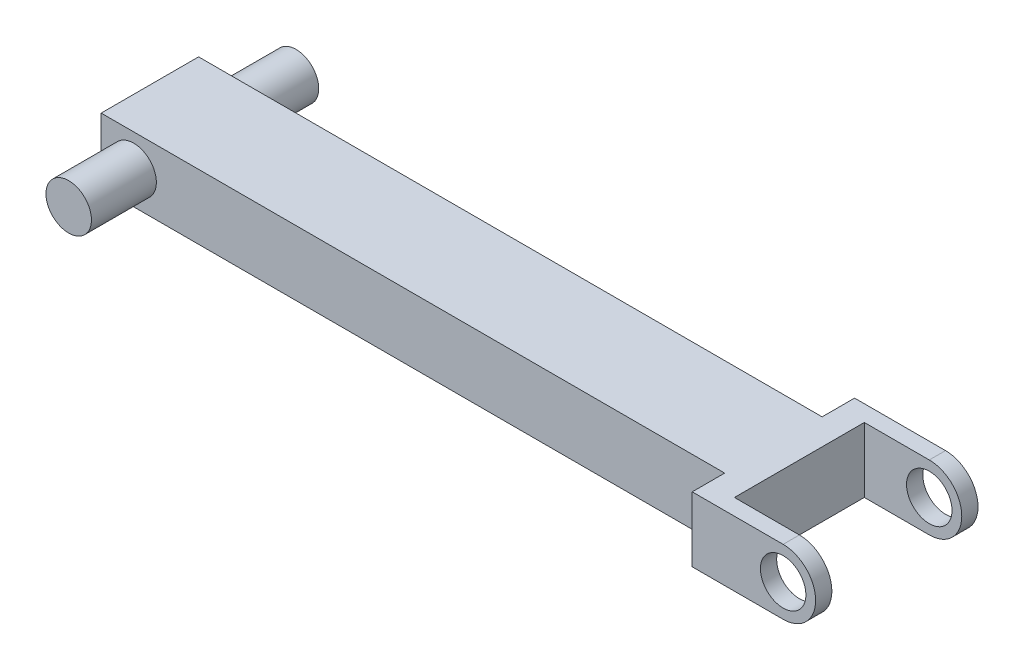
from build123d import *

# Parameters (mm, degrees)
SKETCH1_W           = 50.8
SKETCH1_H           = 5.08
BOSS_EXTRUDE1_DEPTH = 7.62
SKETCH2_R           = 1.778
BOSS_EXTRUDE2_DEPTH = 5.08
BOSS_EXTRUDE3_START = 5.08
SKETCH3_R           = 1.778
BOSS_EXTRUDE3_DEPTH = 5.08
SKETCH4_W           = 2.032
SKETCH4_H           = 5.08
BOSS_EXTRUDE4_DEPTH = 2.54
BOSS_EXTRUDE5_DEPTH = 1.27
SKETCH6_W           = 2.032
SKETCH6_H           = 5.08
BOSS_EXTRUDE6_DEPTH = 2.54
BOSS_EXTRUDE7_START = -1.27
BOSS_EXTRUDE7_DEPTH = 1.27
SKETCH8_R           = 1.778
CUT_EXTRUDE1_DEPTH  = 61.588451045


with BuildPart() as part:
    # Sketch1 → Boss-Extrude1 (new body)
    with BuildSketch(Plane.XY):
        with Locations((25.4, -2.54)):
            Rectangle(SKETCH1_W, SKETCH1_H)
    extrude(amount=BOSS_EXTRUDE1_DEPTH)

    # Sketch2 → Boss-Extrude2 (add)
    with BuildSketch(Plane.XY.offset(7.62)):
        with Locations((2.54, -2.54)):
            Circle(SKETCH2_R)
    extrude(amount=BOSS_EXTRUDE2_DEPTH)

    # Sketch3 → Boss-Extrude3 (add)
    with BuildSketch(Plane(origin=(0, 0, 0), x_dir=(-1, 0, 0), z_dir=(0, 0, -1)).offset(BOSS_EXTRUDE3_START)):
        with Locations(Location((-2.54, -2.54, 0), (0, 0, 180))):
            Circle(SKETCH3_R)
    extrude(amount=-BOSS_EXTRUDE3_DEPTH)

    # Sketch4 → Boss-Extrude4 (add)
    with BuildSketch(Plane.XY.offset(7.62)):
        with Locations((49.784, -2.54)):
            Rectangle(SKETCH4_W, SKETCH4_H)
    extrude(amount=BOSS_EXTRUDE4_DEPTH)

    # Sketch5 → Boss-Extrude5 (add)
    with BuildSketch(Plane.XY.offset(10.16)):
        with BuildLine():
            Line((50.8, 0), (55.88, 0))
            ThreePointArc((55.88, 0), (58.42, -2.54), (55.88, -5.08))
            Line((55.88, -5.08), (50.8, -5.08))
            Line((50.8, -5.08), (50.8, 0))
        make_face()
    extrude(amount=-BOSS_EXTRUDE5_DEPTH)

    # Sketch6 → Boss-Extrude6 (add)
    with BuildSketch(Plane(origin=(0, 0, 0), x_dir=(-1, 0, 0), z_dir=(0, 0, -1))):
        with Locations((-49.784, -2.54)):
            Rectangle(SKETCH6_W, SKETCH6_H)
    extrude(amount=BOSS_EXTRUDE6_DEPTH)

    # Sketch7 → Boss-Extrude7 (add)
    with BuildSketch(Plane(origin=(0, 0, -2.54), x_dir=(-1, 0, 0), z_dir=(0, 0, -1)).offset(BOSS_EXTRUDE7_START)):
        with BuildLine():
            Line((-48.768, 0), (-55.88, 0))
            ThreePointArc((-55.88, 0), (-58.42, -2.54), (-55.88, -5.08))
            Line((-55.88, -5.08), (-48.768, -5.08))
            Line((-48.768, -5.08), (-48.768, 0))
        make_face()
    extrude(amount=BOSS_EXTRUDE7_DEPTH)

    # Sketch8 → Cut-Extrude1 (cut, through all)
    with BuildSketch(Plane(origin=(0, 0, -2.54), x_dir=(-1, 0, 0), z_dir=(0, 0, -1))):
        with Locations((-55.88, -2.54)):
            Circle(SKETCH8_R)
    extrude(amount=-CUT_EXTRUDE1_DEPTH, mode=Mode.SUBTRACT)


solid = part.part
